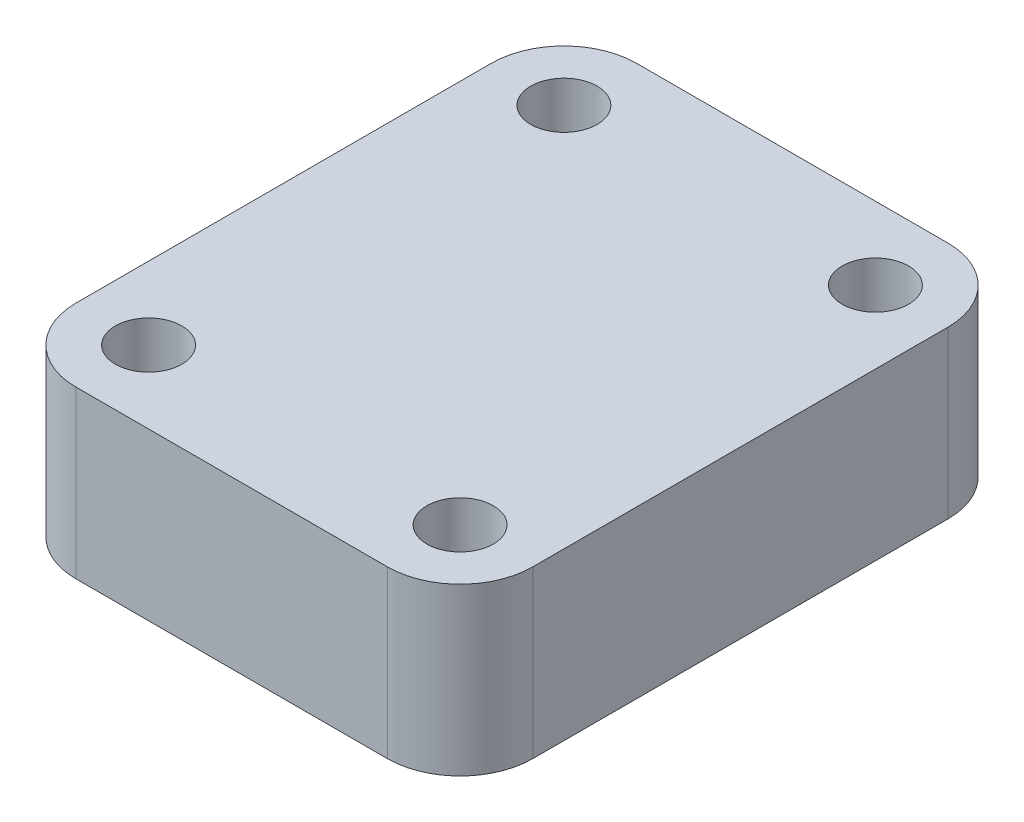
from build123d import *

# Parameters (mm, degrees)
SKETCH1_W            = 22
SKETCH1_H            = 27
BOSS_EXTRUDE1_DEPTH  = 8
M3_CLEARANCE_HOLE1_D = 3.2
FILLET1_R            = 3.5


with BuildPart() as part:
    # Sketch1 → Boss-Extrude1 (new body)
    with BuildSketch(Plane(origin=(0, 0, 0), x_dir=(1, 0, 0), z_dir=(0, 1, 0))):
        Rectangle(SKETCH1_W, SKETCH1_H)
    extrude(amount=BOSS_EXTRUDE1_DEPTH)

    # M3 Clearance Hole1 (through all)
    with Locations(Plane(origin=(0, 8, 0), x_dir=(1, 0, 0), z_dir=(0, 1, 0))):
        with Locations((-7.5, -10), (-7.5, 10), (7.5, 10), (7.5, -10)):
            Hole(M3_CLEARANCE_HOLE1_D / 2)

    # Fillet1
    fillet1_edges = [part.edges().sort_by_distance(p)[0] for p in [
        (-11, 4, -13.5),
        (11, 4, -13.5),
        (11, 4, 13.5),
        (-11, 4, 13.5),
    ]]
    fillet(fillet1_edges, radius=FILLET1_R)


solid = part.part
